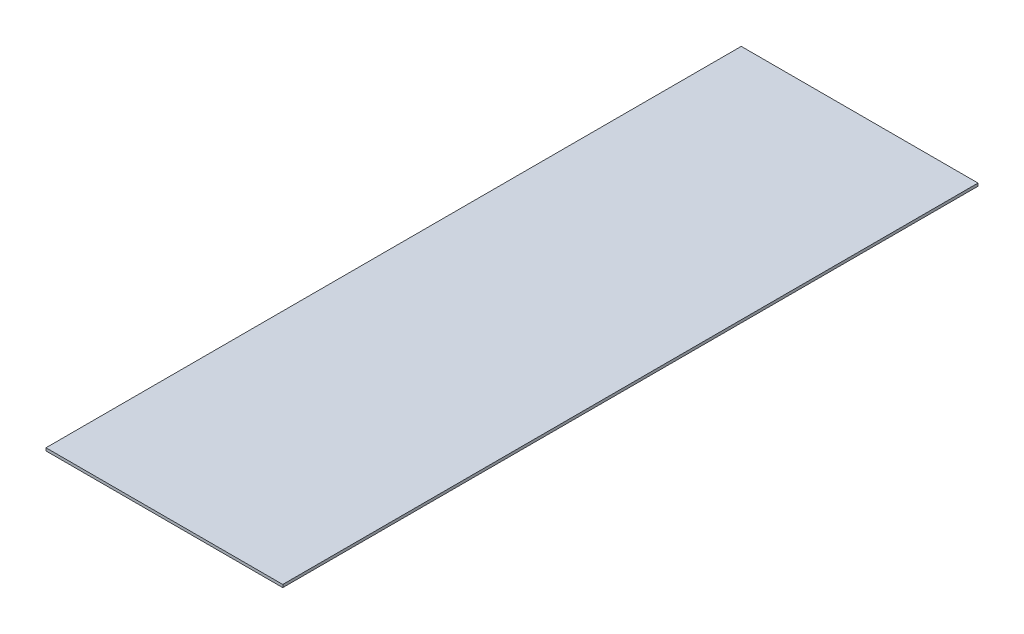
from build123d import *

# Parameters (mm, degrees)
SKETCH1_W           = 170.27
SKETCH1_H           = 500
BOSS_EXTRUDE1_DEPTH = 2


with BuildPart() as part:
    # Sketch1 → Boss-Extrude1 (new body)
    with BuildSketch(Plane(origin=(0, 0, 0), x_dir=(1, 0, 0), z_dir=(0, 1, 0))):
        with Locations((-85.135, -250)):
            Rectangle(SKETCH1_W, SKETCH1_H)
    extrude(amount=BOSS_EXTRUDE1_DEPTH)


solid = part.part
